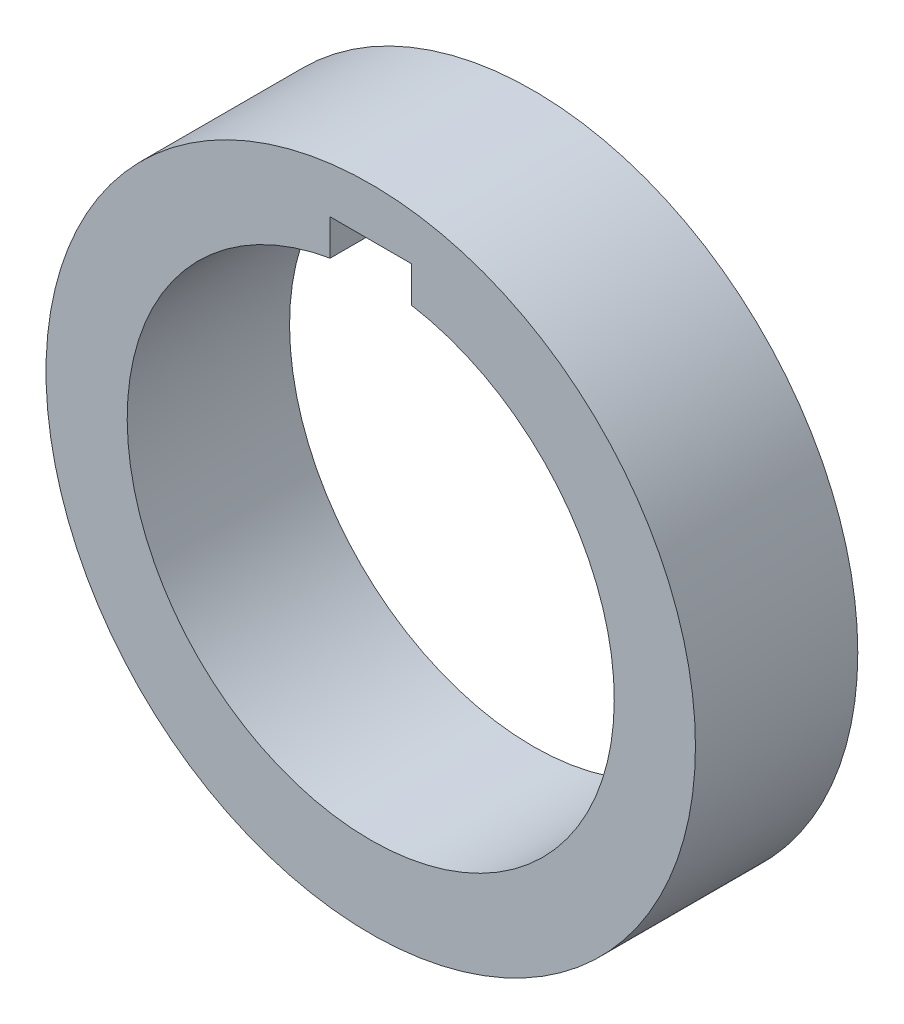
from build123d import *

# Parameters (mm, degrees)
SKETCH1_R           = 20
BOSS_EXTRUDE1_DEPTH = 10


with BuildPart() as part:
    # Sketch1 → Boss-Extrude1 (new body)
    with BuildSketch(Plane.XY):
        Circle(SKETCH1_R)
        with BuildLine():
            Line((-2.5, 14.790199458), (-2.5, 17))
            Line((-2.5, 17), (2.5, 17))
            Line((2.5, 17), (2.5, 14.790199458))
            ThreePointArc((2.5, 14.790199458), (0, -15), (-2.5, 14.790199458))
        make_face(mode=Mode.SUBTRACT)
    extrude(amount=BOSS_EXTRUDE1_DEPTH)


solid = part.part
